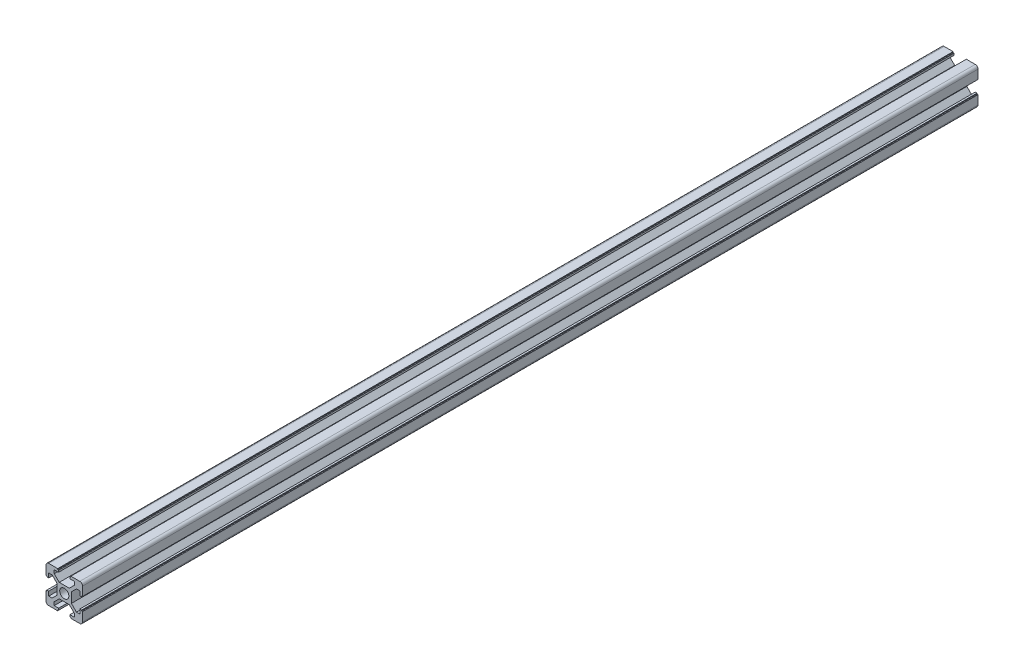
from build123d import *

# Parameters (mm, degrees)
SKETCH1_R           = 2.5
EXTRUDE_1_DEPTH     = 490
SKETCH_1_R          = 1.5
CUT_EXTRUDE_2_DEPTH = 491.299102589


with BuildPart() as part:
    # Sketch1 → 凸台-拉伸1 (new body)
    with BuildSketch(Plane.XY):
        with BuildLine():
            Line((-3.6, 10), (-3.6, 9.5))
            Line((-3.6, 9.5), (-3.1, 9.5))
            Line((-3.1, 9.5), (-3.1, 8.5))
            Line((-3.1, 8.5), (-5.5, 8.5))
            Line((-5.5, 8.5), (-5.5, 6.65))
            Line((-5.5, 6.65), (-2.75, 3.9))
            Line((-2.75, 3.9), (2.75, 3.9))
            Line((2.75, 3.9), (5.5, 6.65))
            Line((5.5, 6.65), (5.5, 8.5))
            Line((5.5, 8.5), (3.1, 8.5))
            Line((3.1, 8.5), (3.1, 9.5))
            Line((3.1, 9.5), (3.6, 9.5))
            Line((3.6, 9.5), (3.6, 10))
            Line((3.6, 10), (8.5, 10))
            ThreePointArc((8.5, 10), (9.560660172, 9.560660172), (10, 8.5))
            Line((10, 8.5), (10, 3.6))
            Line((10, 3.6), (9.5, 3.6))
            Line((9.5, 3.6), (9.5, 3.1))
            Line((9.5, 3.1), (8.5, 3.1))
            Line((8.5, 3.1), (8.5, 5.5))
            Line((8.5, 5.5), (6.65, 5.5))
            Line((6.65, 5.5), (3.9, 2.75))
            Line((3.9, 2.75), (3.9, -2.75))
            Line((3.9, -2.75), (6.65, -5.5))
            Line((6.65, -5.5), (8.5, -5.5))
            Line((8.5, -5.5), (8.5, -3.1))
            Line((8.5, -3.1), (9.5, -3.1))
            Line((9.5, -3.1), (9.5, -3.6))
            Line((9.5, -3.6), (10, -3.6))
            Line((10, -3.6), (10, -8.5))
            ThreePointArc((10, -8.5), (9.560660172, -9.560660172), (8.5, -10))
            Line((8.5, -10), (3.6, -10))
            Line((3.6, -10), (3.6, -9.5))
            Line((3.6, -9.5), (3.1, -9.5))
            Line((3.1, -9.5), (3.1, -8.5))
            Line((3.1, -8.5), (5.5, -8.5))
            Line((5.5, -8.5), (5.5, -6.65))
            Line((5.5, -6.65), (2.75, -3.9))
            Line((2.75, -3.9), (-2.75, -3.9))
            Line((-2.75, -3.9), (-5.5, -6.65))
            Line((-5.5, -6.65), (-5.5, -8.5))
            Line((-5.5, -8.5), (-3.1, -8.5))
            Line((-3.1, -8.5), (-3.1, -9.5))
            Line((-3.1, -9.5), (-3.6, -9.5))
            Line((-3.6, -9.5), (-3.6, -10))
            Line((-3.6, -10), (-8.5, -10))
            ThreePointArc((-8.5, -10), (-9.560660172, -9.560660172), (-10, -8.5))
            Line((-10, -8.5), (-10, -3.6))
            Line((-10, -3.6), (-9.5, -3.6))
            Line((-9.5, -3.6), (-9.5, -3.1))
            Line((-9.5, -3.1), (-8.5, -3.1))
            Line((-8.5, -3.1), (-8.5, -5.5))
            Line((-8.5, -5.5), (-6.65, -5.5))
            Line((-6.65, -5.5), (-3.9, -2.75))
            Line((-3.9, -2.75), (-3.9, 2.75))
            Line((-3.9, 2.75), (-6.65, 5.5))
            Line((-6.65, 5.5), (-8.5, 5.5))
            Line((-8.5, 5.5), (-8.5, 3.1))
            Line((-8.5, 3.1), (-9.5, 3.1))
            Line((-9.5, 3.1), (-9.5, 3.6))
            Line((-9.5, 3.6), (-10, 3.6))
            Line((-10, 3.6), (-10, 8.5))
            ThreePointArc((-10, 8.5), (-9.560660172, 9.560660172), (-8.5, 10))
            Line((-8.5, 10), (-3.6, 10))
        make_face()
        Circle(SKETCH1_R, mode=Mode.SUBTRACT)
    extrude(amount=EXTRUDE_1_DEPTH)

    # 草图1 → 切除-拉伸2 (cut, through all)
    with BuildSketch(Plane(origin=(0, 3.9, 0), x_dir=(1, 0, 0), z_dir=(0, 1, 0))):
        with Locations(Location((0, -460, 0), (0, 0, 180))):
            Circle(SKETCH_1_R)
        with Locations(Location((0, -441, 0), (0, 0, 180))):
            Circle(SKETCH_1_R)
    extrude(amount=-CUT_EXTRUDE_2_DEPTH, mode=Mode.SUBTRACT)


solid = part.part
